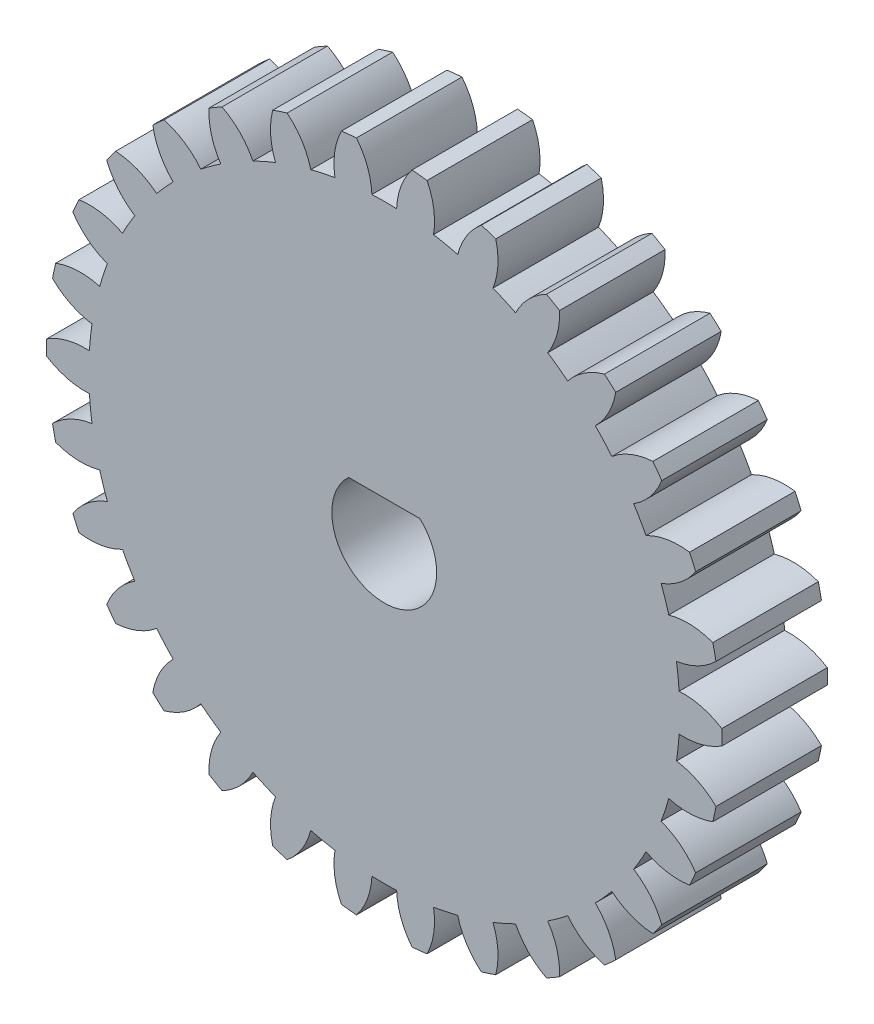
from build123d import *

# Parameters (mm, degrees)
SKETCH1_R           = 20.32
OUTER_CIRCLE_DEPTH  = 6.35
TOOTH_CUT_DEPTH     = 30.430040775
TEETH_PATTERN_COUNT = 30
CUT_EXTRUDE1_DEPTH  = 30.382561533


with BuildPart() as part:
    # Sketch1 → Outer Circle (new body)
    with BuildSketch(Plane.XY):
        Circle(SKETCH1_R)
    extrude(amount=OUTER_CIRCLE_DEPTH)

    # Sketch2 → Tooth Cut (cut, through all)
    with BuildSketch(Plane.XY.offset(6.35)):
        with BuildLine():
            ThreePointArc((-0.743845606, 17.764433391), (0, 17.78), (0.743845606, 17.764433391))
            ThreePointArc((0.743845606, 17.764433391), (1.009950749, 19.081439594), (1.671040922, 20.251173355))
            ThreePointArc((1.671040922, 20.251173355), (0, 20.32), (-1.671040922, 20.251173355))
            ThreePointArc((-1.671040922, 20.251173355), (-1.009950749, 19.081439594), (-0.743845606, 17.764433391))
        make_face()
    tooth_cut = extrude(amount=-TOOTH_CUT_DEPTH, mode=Mode.SUBTRACT)

    # Teeth Pattern: Tooth Cut ×30 about axis
    teeth_pattern_axis = Axis((0, 0, 0), (0, 0, 1))
    for i in range(1, TEETH_PATTERN_COUNT):
        add(tooth_cut.rotate(teeth_pattern_axis, i * 360 / TEETH_PATTERN_COUNT), mode=Mode.SUBTRACT)

    # Sketch3 → Cut-Extrude1 (cut, through all)
    with BuildSketch(Plane.XY.offset(6.35)):
        with BuildLine():
            Line((0, 2.31775), (-2.141974636, 2.31775))
            ThreePointArc((-2.141974636, 2.31775), (-2.938938883, -1.150068974), (0, -3.15595))
            Line((0, -3.15595), (0, 2.31775))
        make_face()
        with BuildLine():
            Line((2.141974636, 2.31775), (0, 2.31775))
            Line((0, 2.31775), (0, -3.15595))
            ThreePointArc((0, -3.15595), (2.231593646, -2.231593646), (3.15595, 0))
            ThreePointArc((3.15595, 0), (2.891365184, 1.264922043), (2.141974636, 2.31775))
        make_face()
    extrude(amount=-CUT_EXTRUDE1_DEPTH, mode=Mode.SUBTRACT)


solid = part.part
